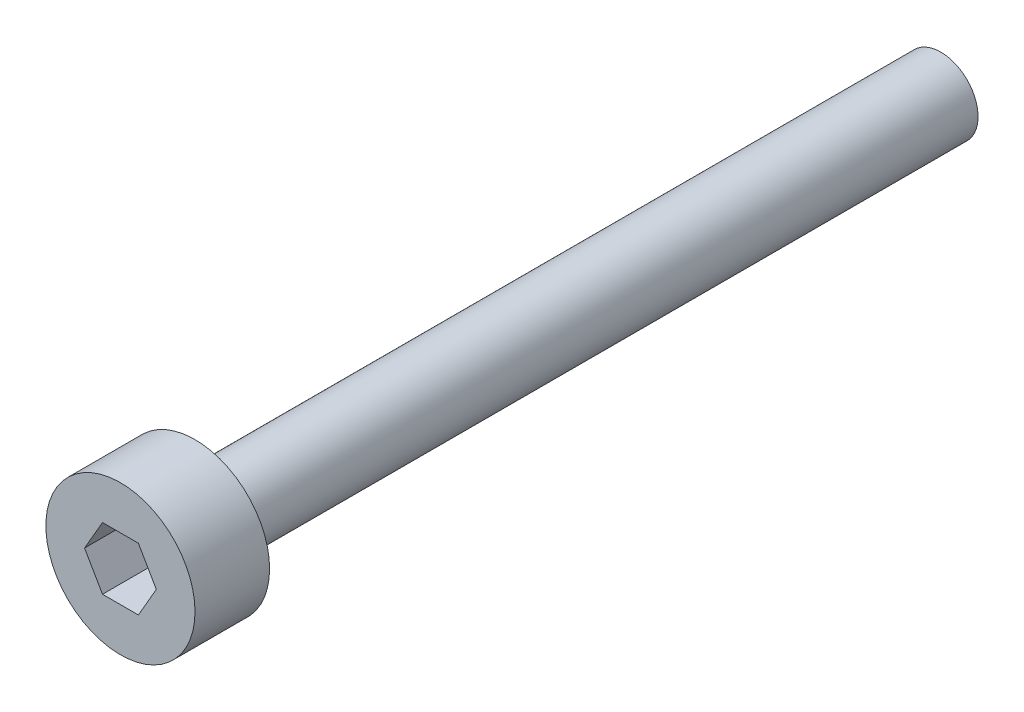
from build123d import *

# Parameters (mm, degrees)
SKETCH_5_R          = 3
EXTRUDE_1_DEPTH     = 3
CUT_EXTRUDE_1_DEPTH = 2
SKETCH_7_R          = 1.5
EXTRUDE_2_DEPTH     = 30


with BuildPart() as part:
    # ｽｹｯﾁ5 → ﾎﾞｽ - 押し出し1 (new body)
    with BuildSketch(Plane.XY):
        Circle(SKETCH_5_R)
    extrude(amount=EXTRUDE_1_DEPTH)

    # ｽｹｯﾁ6 → ｶｯﾄ - 押し出し1 (cut)
    with BuildSketch(Plane.XY.offset(3)):
        Polygon((1.443375673, 0), (0.721687836, 1.25), (-0.721687836, 1.25), (-1.443375673, 0), (-0.721687836, -1.25), (0.721687836, -1.25), align=None)
    extrude(amount=-CUT_EXTRUDE_1_DEPTH, mode=Mode.SUBTRACT)

    # ｽｹｯﾁ7 → ﾎﾞｽ - 押し出し2 (add)
    with BuildSketch(Plane(origin=(0, 0, 0), x_dir=(-1, 0, 0), z_dir=(0, 0, -1))):
        Circle(SKETCH_7_R)
    extrude(amount=EXTRUDE_2_DEPTH)


solid = part.part
